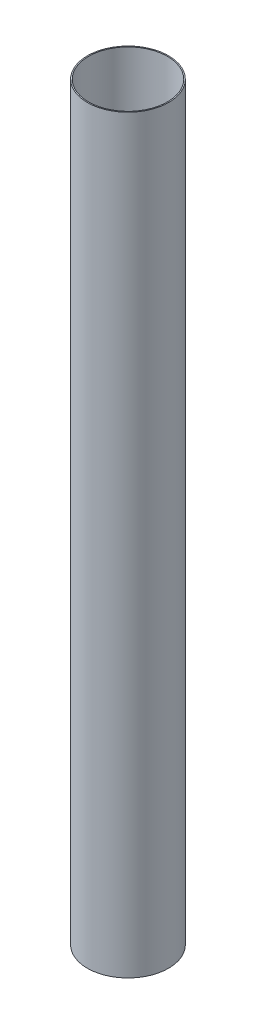
from build123d import *

# Parameters (mm, degrees)
SKETCH1_R           = 78.359
SKETCH1_R_2         = 76.2
BOSS_EXTRUDE1_DEPTH = 1447.8


with BuildPart() as part:
    # Sketch1 → Boss-Extrude1 (new body)
    with BuildSketch(Plane(origin=(0, 0, 0), x_dir=(1, 0, 0), z_dir=(0, 1, 0))):
        with Locations(Location((0, 0, 0), (0, 0, 270))):
            Circle(SKETCH1_R)
        with Locations(Location((0, 0, 0), (0, 0, 270))):
            Circle(SKETCH1_R_2, mode=Mode.SUBTRACT)
    extrude(amount=BOSS_EXTRUDE1_DEPTH)


solid = part.part
